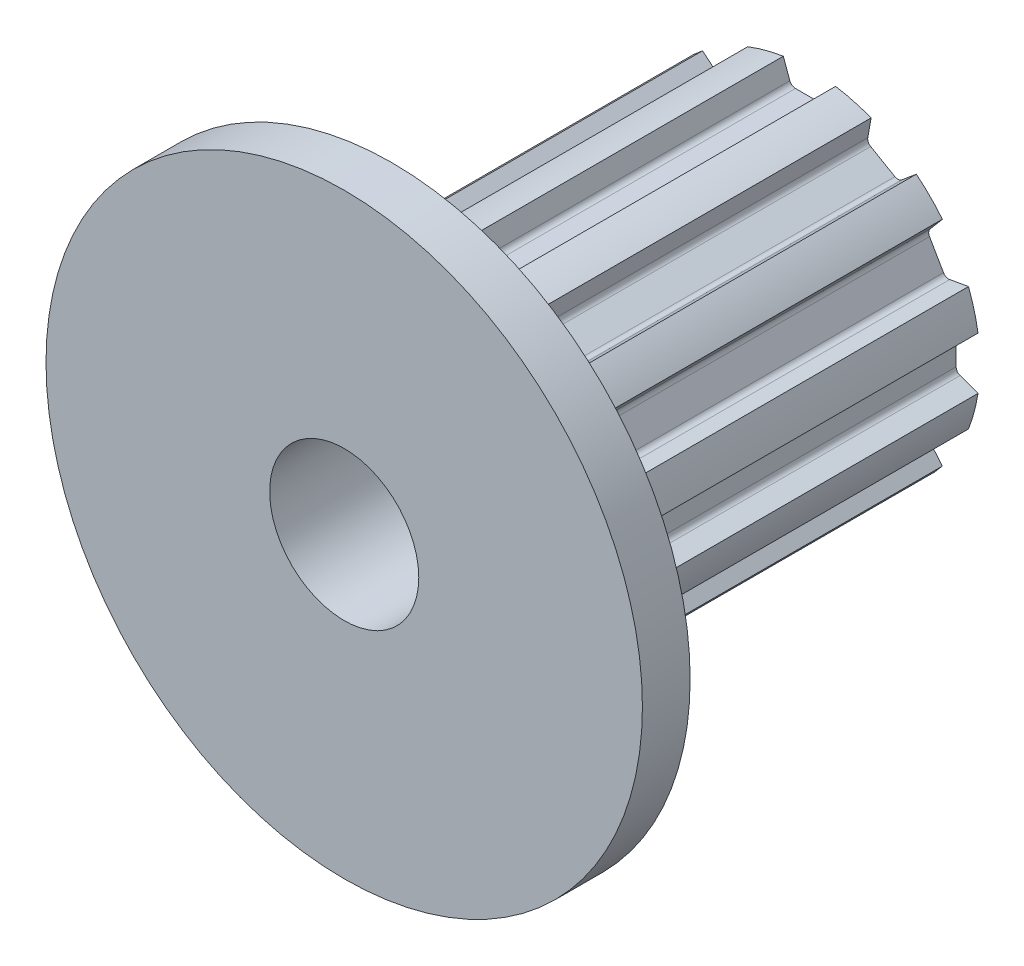
from build123d import *

# Parameters (mm, degrees)
SKETCH1_R        = 3.6322
BASEPULLEY_DEPTH = 8.89
GROOVE_DEPTH     = 4.445
GROOVES_COUNT    = 12
GROOVES_ANGLE    = 330
SKETCH4_W        = 1.016
SKETCH4_H        = 6.35
BORSKE_R         = 1.5875
BORE_DEPTH       = 14.370633343


with BuildPart() as part:
    # Sketch1 → BasePulley (new body)
    with BuildSketch(Plane.XY):
        Circle(SKETCH1_R)
    extrude(amount=-BASEPULLEY_DEPTH)

    # Sketch3 → Groove (cut, symmetric)
    with BuildSketch(Plane.XY.offset(-4.445)):
        with BuildLine():
            Line((-0.5715, 3.6322), (-0.5715, 29.0322))
            Line((-0.5715, 29.0322), (0.5715, 29.0322))
            Line((0.5715, 29.0322), (0.5715, 3.6322))
            Line((0.5715, 3.6322), (0.417017726, 3.207763442))
            ThreePointArc((0.417017726, 3.207763442), (0.370520971, 3.14716769), (0.297676764, 3.1242))
            Line((0.297676764, 3.1242), (-0.297676764, 3.1242))
            ThreePointArc((-0.297676764, 3.1242), (-0.370520971, 3.14716769), (-0.417017726, 3.207763442))
            Line((-0.417017726, 3.207763442), (-0.5715, 3.6322))
        make_face()
    groove = extrude(amount=GROOVE_DEPTH, both=True, mode=Mode.SUBTRACT)

    # Grooves: Groove ×12 about axis
    grooves_axis = Axis((0, 0, -8.89), (0, 0, 1))
    for i in range(1, GROOVES_COUNT):
        add(groove.rotate(grooves_axis, i * GROOVES_ANGLE / (GROOVES_COUNT - 1)), mode=Mode.SUBTRACT)

    # Sketch4 → BaseHub (revolve)
    with BuildSketch(Plane(origin=(0, 0, 0), x_dir=(0, 0, -1), z_dir=(1, 0, 0)), mode=Mode.PRIVATE) as basehub_sk:
        with Locations((-0.508, 3.175)):
            Rectangle(SKETCH4_W, SKETCH4_H)
    revolve(basehub_sk.sketch.rotate(Axis((0, 0, 0), (0, 0, -1)), 90), axis=Axis((0, 0, 0), (0, 0, -1)))

    # BorSke → Bore (cut, through all)
    with BuildSketch(Plane.XY.offset(1.016)):
        Circle(BORSKE_R)
    extrude(amount=-BORE_DEPTH, mode=Mode.SUBTRACT)


solid = part.part
